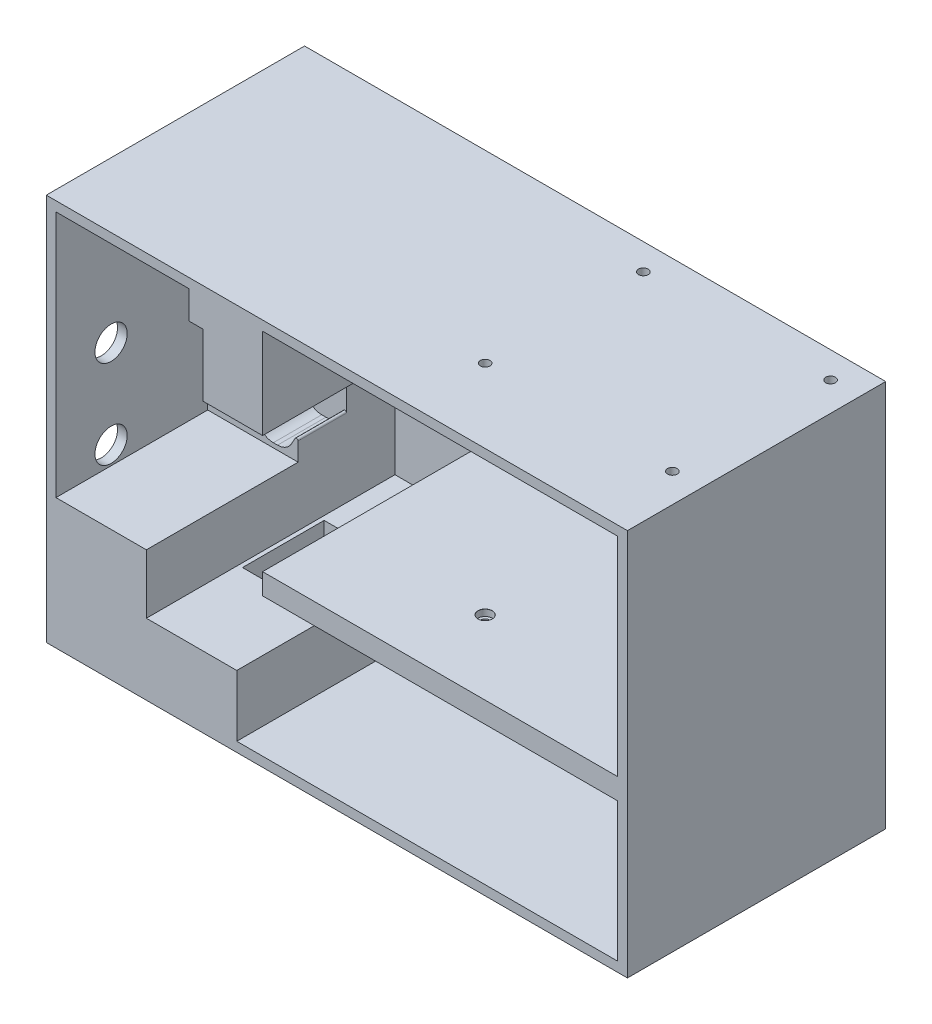
from build123d import *

# Parameters (mm, degrees)
SKETCH1_W                     = 120
SKETCH1_H                     = 180
BOSS_EXTRUDE1_DEPTH           = 80
CUT_EXTRUDE2_DEPTH            = 77
SKETCH5_W                     = 18
SKETCH5_H                     = 28
CUT_EXTRUDE3_DEPTH            = 77
SKETCH7_W                     = 3.814242132
SKETCH7_H                     = 8.503079505
BOSS_EXTRUDE2_DEPTH           = 15
SKETCH8_W                     = 28
SKETCH8_H                     = 12.638642759
CUT_EXTRUDE4_DEPTH            = 62
SKETCH10_W                    = 28
SKETCH10_H                    = 77
BOSS_EXTRUDE5_DEPTH           = 4.8
BOSS_EXTRUDE6_DEPTH           = 15
FILLET1_R                     = 0.5
FILLET2_R                     = 5
CBORE_FOR_M2_SHCS1_AT_2_COUNT = 2
CBORE_FOR_M2_SHCS1_AT_2_PITCH = 58
CBORE_FOR_M2_SHCS1_AT_3_COUNT = 2
CBORE_FOR_M2_SHCS1_AT_3_PITCH = 49
CBORE_FOR_M2_SHCS1_AT_4_COUNT = 2
CBORE_FOR_M2_SHCS1_AT_4_PITCH = 75.927597091
CUT_EXTRUDE8_DEPTH            = 3
CUT_EXTRUDE8_DEPTH_BACK       = 45
FILLET3_R                     = 2
SKETCH21_R                    = 5
CUT_EXTRUDE9_DEPTH            = 25
SKETCH22_W                    = 22
SKETCH22_H                    = 77
BOSS_EXTRUDE7_DEPTH           = 19
SKETCH23_W                    = 13
SKETCH23_H                    = 19.5
CUT_EXTRUDE10_DEPTH           = 30
SKETCH24_W                    = 16
SKETCH24_H                    = 22
CUT_EXTRUDE11_DEPTH           = 8
SKETCH25_W                    = 15.26548048
SKETCH25_H                    = 25.296285881
CUT_EXTRUDE12_DEPTH           = 12
SKETCH26_R                    = 1.5
CUT_EXTRUDE13_DEPTH           = 73
CUT_EXTRUDE14_DEPTH           = 49
CUT_EXTRUDE14_DEPTH_BACK      = 2
SKETCH27_W                    = 3.814242132
SKETCH27_H                    = 15
SKETCH28_W                    = 45.579677418
SKETCH28_H                    = 67.957985629
CUT_EXTRUDE15_DEPTH           = 29
SKETCH29_W                    = 19
SKETCH29_H                    = 77
CUT_EXTRUDE17_DEPTH           = 8
SKETCH30_W                    = 91.153951036
SKETCH30_H                    = 60.622575867
SKETCH30_R                    = 3
CUT_EXTRUDE18_DEPTH           = 3
FILLET4_R                     = 5


with BuildPart() as part:
    # Sketch1 → Boss-Extrude1 (new body)
    with BuildSketch(Plane(origin=(0, 0, 0), x_dir=(0, 1, 0), z_dir=(0, 0, 1))):
        Rectangle(SKETCH1_W, SKETCH1_H)
    extrude(amount=BOSS_EXTRUDE1_DEPTH)

    # Sketch4 → Cut-Extrude2 (cut)
    with BuildSketch(Plane(origin=(-1315.649869597, -737.347167088, 80), x_dir=(1, 0, 0), z_dir=(0, 0, 1))):
        Polygon((1292.649869597, 766.347167088), (1256.649869597, 766.347167088), (1256.649869597, 794.347167088), (1228.649869597, 794.347167088), (1228.649869597, 730.347167088), (1256.649869597, 730.347167088), (1256.649869597, 699.347167088), (1267.649869597, 699.347167088), (1267.649869597, 680.347167088), (1289.649869597, 680.347167088), (1289.649869597, 699.347167088), (1292.649869597, 699.347167088), (1292.649869597, 680.347167088), (1402.649869597, 680.347167088), (1402.649869597, 723.347167088), (1292.649869597, 723.347167088), (1292.649869597, 729.847167088), (1402.649869597, 729.847167088), (1402.649869597, 794.347167088), (1292.649869597, 794.347167088), align=None)
    extrude(amount=-CUT_EXTRUDE2_DEPTH, mode=Mode.SUBTRACT)

    # Sketch5 → Cut-Extrude3 (cut)
    with BuildSketch(Plane(origin=(-1315.649869597, -737.347167088, 80), x_dir=(1, 0, 0), z_dir=(0, 0, 1))):
        with Locations((1265.649869597, 780.347167088)):
            Rectangle(SKETCH5_W, SKETCH5_H)
    extrude(amount=-CUT_EXTRUDE3_DEPTH, mode=Mode.SUBTRACT)

    # Sketch7 → Boss-Extrude2 (add)
    with BuildSketch(Plane.XY.offset(3)):
        Polygon((-66.505568734, 48.496920495), (-59, 48.496920495), (-59, 57), (-67.961780033, 57), align=None)
        Polygon((-59, -7), (-59, 1.503079505), (-66.505568734, 1.503079505), (-67.961780033, -7), align=None)
        with Locations((-73.022462164, -2.748460247)):
            Rectangle(SKETCH7_W, SKETCH7_H)
        with Locations((-73.022462164, 52.748460248)):
            Rectangle(SKETCH7_W, SKETCH7_H)
        Polygon((-87, 57), (-87, 48.496920495), (-79.494431266, 48.496920495), (-78.038219967, 57), align=None)
        Polygon((-79.494431266, 1.503079505), (-87, 1.503079505), (-87, -7), (-77.995952978, -7), align=None)
    extrude(amount=BOSS_EXTRUDE2_DEPTH)

    # Sketch8 → Cut-Extrude4 (cut)
    with BuildSketch(Plane.XY.offset(80)):
        with Locations((-73, -13.319321379)):
            Rectangle(SKETCH8_W, SKETCH8_H)
    extrude(amount=-CUT_EXTRUDE4_DEPTH, mode=Mode.SUBTRACT)

    # Sketch10 → Boss-Extrude5 (add)
    with BuildSketch(Plane(origin=(-41, 0, 0), x_dir=(0, -1, 0), z_dir=(-1, 0, 0))):
        with Locations((-43, 41.5)):
            Rectangle(SKETCH10_W, SKETCH10_H)
    extrude(amount=BOSS_EXTRUDE5_DEPTH)

    # Sketch12 → Boss-Extrude6 (add)
    with BuildSketch(Plane.XY.offset(18)):
        Polygon((-59, -11.981340953), (-62.404767659, -18.250642754), (-69.565878077, -18.250642754), (-74.409105395, -9.838317886), (-87, -9.838317886), (-87, -19.638642759), (-59, -19.638642759), align=None)
    extrude(amount=BOSS_EXTRUDE6_DEPTH)

    # Fillet1
    fillet1_edges = [part.edges().sort_by_distance(p)[0] for p in [
        (-59, -11.981340953, 25.5),
    ]]
    fillet(fillet1_edges, radius=FILLET1_R)

    # Fillet2
    fillet2_edges = [part.edges().sort_by_distance(p)[0] for p in [
        (-62.404767659, -18.250642754, 25.5),
        (-69.565878077, -18.250642754, 25.5),
    ]]
    fillet(fillet2_edges, radius=FILLET2_R)

    # Sketch15 → CBORE for M2 SHCS1 (revolve, cut)
    with BuildSketch(Plane(origin=(81.053987796, -7.5, 57.123857513), x_dir=(0, 0, 1), z_dir=(1, 0, 0))):
        Polygon((0, 0), (0, 7.281118805), (1.3, 6.5), (1.3, 2), (2.2, 2), (2.2, 0.025), (2.225, 0), align=None)
    cbore_for_m2_shcs1 = revolve(axis=Axis((81.053987796, -1.15, 57.123857513), (0, -1, 0)), mode=Mode.SUBTRACT)

    # CBORE for M2 SHCS1 at 2: CBORE for M2 SHCS1 ×2
    with Locations(*[(-i * CBORE_FOR_M2_SHCS1_AT_2_PITCH, 0, 0) for i in range(1, CBORE_FOR_M2_SHCS1_AT_2_COUNT)]):
        add(cbore_for_m2_shcs1, mode=Mode.SUBTRACT)

    # CBORE for M2 SHCS1 at 3: CBORE for M2 SHCS1 ×2
    with Locations(*[(0, 0, -i * CBORE_FOR_M2_SHCS1_AT_3_PITCH) for i in range(1, CBORE_FOR_M2_SHCS1_AT_3_COUNT)]):
        add(cbore_for_m2_shcs1, mode=Mode.SUBTRACT)

    # CBORE for M2 SHCS1 at 4: CBORE for M2 SHCS1 ×2
    with Locations(*[Vector(-0.7638856255460443, 0, -0.6453516491682101) * (i * CBORE_FOR_M2_SHCS1_AT_4_PITCH) for i in range(1, CBORE_FOR_M2_SHCS1_AT_4_COUNT)]):
        add(cbore_for_m2_shcs1, mode=Mode.SUBTRACT)

    # Sketch18 → Cut-Extrude8 (cut, two sides: drawn at the far end of the back side and taken through both)
    with BuildSketch(Plane(origin=(0, 0, 60), x_dir=(0, -1, 0), z_dir=(0, 0, 1)).offset(-CUT_EXTRUDE8_DEPTH_BACK)):
        Polygon((62.758026494, -84.300198527), (62.758026494, -70.435312794), (58.056801253, -70.435312794), (55.726541794, -68.105053334), (52.155556116, -68.105053334), (52.155556116, -78.542615973), (55.726541794, -84.300198527), align=None)
    extrude(amount=CUT_EXTRUDE8_DEPTH + CUT_EXTRUDE8_DEPTH_BACK, mode=Mode.SUBTRACT)

    # Fillet3
    fillet3_edges = [part.edges().sort_by_distance(p)[0] for p in [
        (-84.300198527, -60, 39),
        (-84.300198527, -55.726541794, 39),
        (-70.435312794, -58.056801253, 39),
        (-68.105053334, -52.155556116, 39),
        (-78.542615973, -52.155556116, 39),
    ]]
    fillet(fillet3_edges, radius=FILLET3_R)

    # Sketch21 → Cut-Extrude9 (cut)
    with BuildSketch(Plane(origin=(-90, 0, 0), x_dir=(0, -1, 0), z_dir=(-1, 0, 0))):
        with Locations((14, 62.936860053)):
            Circle(SKETCH21_R)
        with Locations((-13.368287607, 62.936860053)):
            Circle(SKETCH21_R)
    extrude(amount=-CUT_EXTRUDE9_DEPTH, mode=Mode.SUBTRACT)

    # Sketch22 → Boss-Extrude7 (add)
    with BuildSketch(Plane(origin=(0, -57, 0), x_dir=(-1, 0, 0), z_dir=(0, 1, 0))):
        with Locations((37, 41.5)):
            Rectangle(SKETCH22_W, SKETCH22_H)
    extrude(amount=BOSS_EXTRUDE7_DEPTH)

    # Sketch23 → Cut-Extrude10 (cut)
    with BuildSketch(Plane.XZ.offset(60)):
        with Locations((-49.893782672, 39.05711255)):
            Rectangle(SKETCH23_W, SKETCH23_H)
    extrude(amount=-CUT_EXTRUDE10_DEPTH, mode=Mode.SUBTRACT)

    # Sketch24 → Cut-Extrude11 (cut)
    with BuildSketch(Plane.XZ.offset(60)):
        with Locations((-49.893782672, 39.05711255)):
            Rectangle(SKETCH24_W, SKETCH24_H)
    extrude(amount=-CUT_EXTRUDE11_DEPTH, mode=Mode.SUBTRACT)

    # Sketch25 → Cut-Extrude12 (cut)
    with BuildSketch(Plane(origin=(0, -38, 0), x_dir=(-1, 0, 0), z_dir=(0, 1, 0))):
        with Locations((50.082493717, 38.865083442)):
            Rectangle(SKETCH25_W, SKETCH25_H)
    extrude(amount=-CUT_EXTRUDE12_DEPTH, mode=Mode.SUBTRACT)

    # Sketch26 → Cut-Extrude13 (cut)
    with BuildSketch(Plane(origin=(0, -7.5, 0), x_dir=(-1, 0, 0), z_dir=(0, 1, 0))):
        with Locations(Location((-23.053987796, 57.123857513, 0), (0, 0, 270))):
            Circle(SKETCH26_R)
        with Locations(Location((-23.053987796, 8.123857513, 0), (0, 0, 270))):
            Circle(SKETCH26_R)
        with Locations(Location((-81.053987796, 8.123857513, 0), (0, 0, 270))):
            Circle(SKETCH26_R)
        with Locations(Location((-81.053987796, 57.123857513, 0), (0, 0, 270))):
            Circle(SKETCH26_R)
    extrude(amount=CUT_EXTRUDE13_DEPTH, mode=Mode.SUBTRACT)

    # Sketch27 → Cut-Extrude14 (cut, two sides: drawn at the far end of the back side and taken through both)
    with BuildSketch(Plane(origin=(0, 1.503079505, 0), x_dir=(-1, 0, 0), z_dir=(0, 1, 0)).offset(-CUT_EXTRUDE14_DEPTH_BACK)):
        with Locations((73.022462164, 10.5)):
            Rectangle(SKETCH27_W, SKETCH27_H)
    extrude(amount=CUT_EXTRUDE14_DEPTH + CUT_EXTRUDE14_DEPTH_BACK, mode=Mode.SUBTRACT)

    # Sketch28 → Cut-Extrude15 (cut)
    with BuildSketch(Plane.XY.offset(80)):
        with Locations((-64.210161291, 14.340350056)):
            Rectangle(SKETCH28_W, SKETCH28_H)
    extrude(amount=-CUT_EXTRUDE15_DEPTH, mode=Mode.SUBTRACT)

    # Sketch29 → Cut-Extrude17 (cut)
    with BuildSketch(Plane.YZ.offset(-23)):
        with Locations((-47.5, 41.5)):
            Rectangle(SKETCH29_W, SKETCH29_H)
    extrude(amount=-CUT_EXTRUDE17_DEPTH, mode=Mode.SUBTRACT)

    # Sketch30 → Cut-Extrude18 (cut)
    with BuildSketch(Plane.XZ.offset(14)):
        with Locations((41.423024482, 33.311287933)):
            Rectangle(SKETCH30_W, SKETCH30_H)
        with Locations(Location((23.053987796, 8.123857513, 0), (0, 0, 270))):
            Circle(SKETCH30_R, mode=Mode.SUBTRACT)
        with Locations(Location((23.053987796, 57.123857513, 0), (0, 0, 270))):
            Circle(SKETCH30_R, mode=Mode.SUBTRACT)
        with Locations(Location((81.053987796, 8.123857513, 0), (0, 0, 270))):
            Circle(SKETCH30_R, mode=Mode.SUBTRACT)
        with Locations(Location((81.053987796, 57.123857513, 0), (0, 0, 270))):
            Circle(SKETCH30_R, mode=Mode.SUBTRACT)
    extrude(amount=-CUT_EXTRUDE18_DEPTH, mode=Mode.SUBTRACT)

    # Fillet4
    fillet4_edges = [part.edges().sort_by_distance(p)[0] for p in [
        (87, -12.5, 63.622575867),
        (-4.153951036, -12.5, 3),
        (-4.153951036, -12.5, 63.622575867),
    ]]
    fillet(fillet4_edges, radius=FILLET4_R)


solid = part.part
